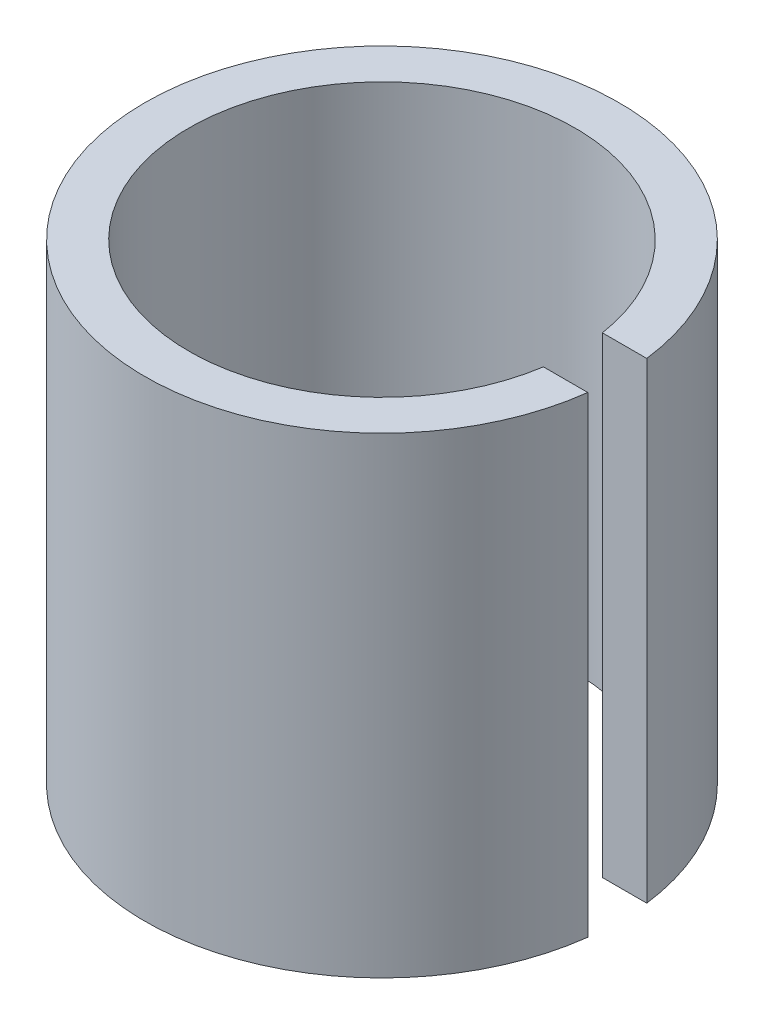
from build123d import *

# Parameters (mm, degrees)
BOSS_EXTRUDE1_DEPTH = 12


with BuildPart() as part:
    # Sketch1 → Boss-Extrude1 (new body)
    with BuildSketch(Plane(origin=(0, 0, 0), x_dir=(1, 0, 0), z_dir=(0, 1, 0))):
        with BuildLine():
            Line((4.857440169, -0.75), (5.98569597, -0.75))
            ThreePointArc((5.98569597, -0.75), (-6.0325, 0), (5.98569597, 0.75))
            Line((5.98569597, 0.75), (4.857440169, 0.75))
            ThreePointArc((4.857440169, 0.75), (-4.915, 0), (4.857440169, -0.75))
        make_face()
    extrude(amount=BOSS_EXTRUDE1_DEPTH)


solid = part.part
